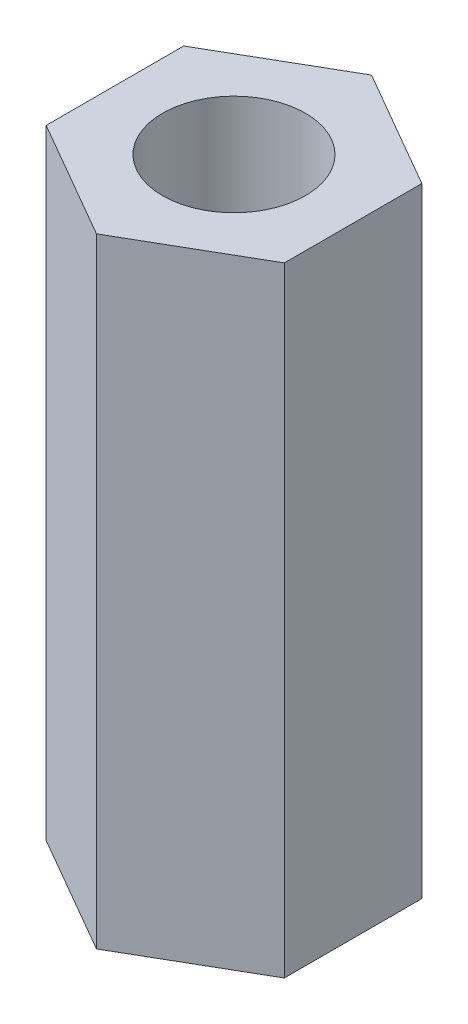
from build123d import *

# Parameters (mm, degrees)
EXTRUDE_1_DEPTH     = 13
CUT_EXTRUDE_1_REACH = 15.549
SKETCH_2_R          = 1.5


with BuildPart() as part:
    # 草圖1 → 填料-伸長1 (new body)
    with BuildSketch(Plane(origin=(0, 0, 0), x_dir=(1, 0, 0), z_dir=(0, 1, 0))):
        Polygon((0, 2.886751346), (-2.5, 1.443375673), (-2.5, -1.443375673), (0, -2.886751346), (2.5, -1.443375673), (2.5, 1.443375673), align=None)
    extrude(amount=EXTRUDE_1_DEPTH)

    # 草圖2 → 除料-伸長1 (cut, up to next)
    with BuildSketch(Plane(origin=(0, 13, 0), x_dir=(-1, 0, 0), z_dir=(0, 1, 0)), mode=Mode.PRIVATE) as cut_extrude_1_sk1:
        with Locations(Location((0, 0, 0), (0, 0, 90))):
            Circle(SKETCH_2_R)
    cut_extrude_1_tool1 = extrude(cut_extrude_1_sk1.sketch, amount=-CUT_EXTRUDE_1_REACH, mode=Mode.PRIVATE) & part.part
    add(cut_extrude_1_tool1.solids().sort_by_distance((0, 13, 0))[0], mode=Mode.SUBTRACT)


solid = part.part
